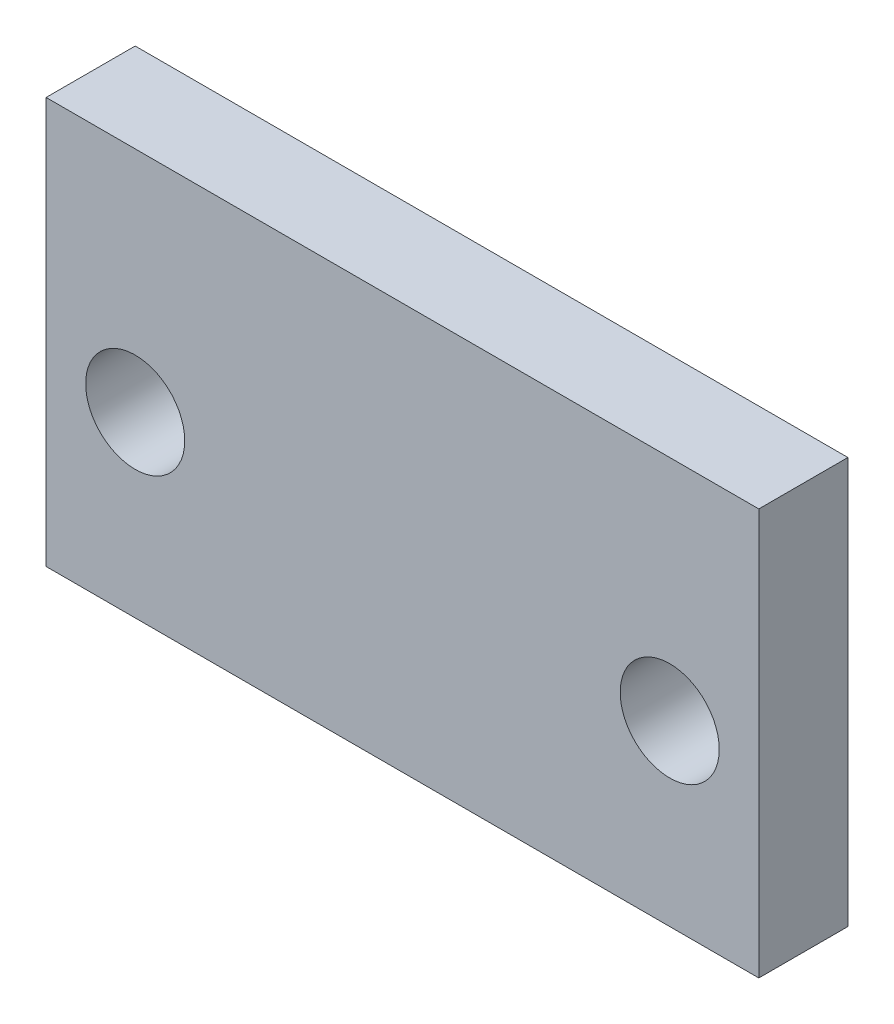
from build123d import *

# Parameters (mm, degrees)
SKETCH1_W      = 25.4
SKETCH1_H      = 14.478
SKETCH1_R      = 1.7653
EXTRUDE1_DEPTH = 3.175


with BuildPart() as part:
    # Sketch1 → Extrude1 (new body)
    with BuildSketch(Plane.XY):
        Rectangle(SKETCH1_W, SKETCH1_H)
        with Locations((-9.525, -0.889)):
            Circle(SKETCH1_R, mode=Mode.SUBTRACT)
        with Locations((9.525, -0.889)):
            Circle(SKETCH1_R, mode=Mode.SUBTRACT)
    extrude(amount=EXTRUDE1_DEPTH)


solid = part.part
